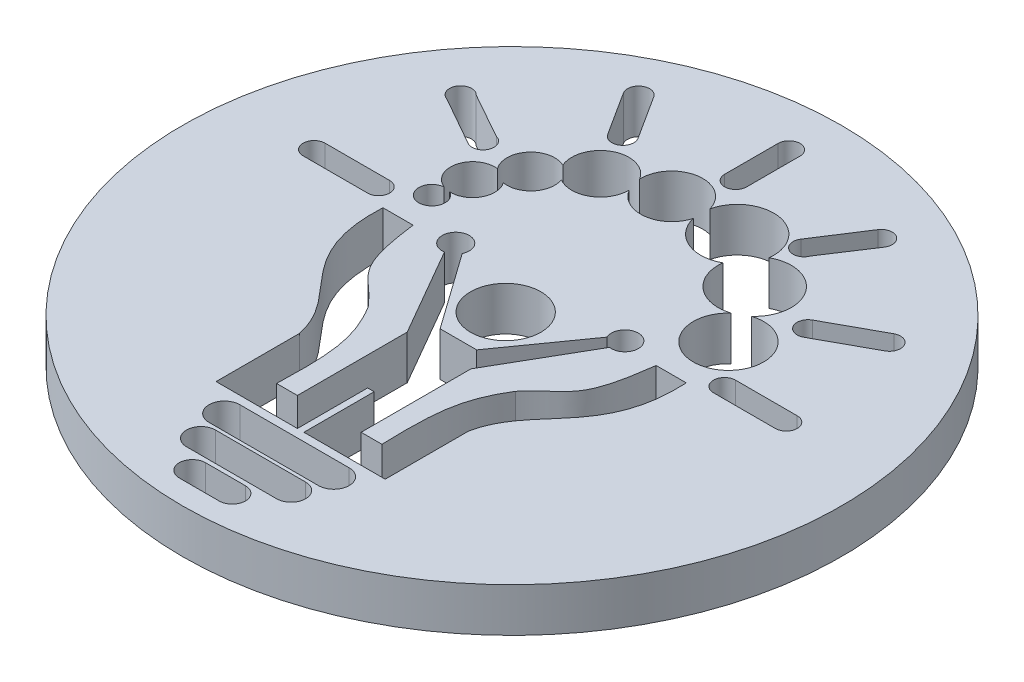
from build123d import *

# Parameters (mm, degrees)
SKETCH2_R           = 75
BOSS_EXTRUDE2_DEPTH = 10
SKETCH1_R           = 8
CUT_EXTRUDE2_DEPTH  = 10


with BuildPart() as part:
    # Sketch2 → Boss-Extrude2 (new body)
    with BuildSketch(Plane(origin=(0, 0, 0), x_dir=(1, 0, 0), z_dir=(0, 1, 0))):
        with Locations(Location((0, 0, 0), (0, 0, 270))):
            Circle(SKETCH2_R)
    extrude(amount=BOSS_EXTRUDE2_DEPTH)

    # Sketch1 → Cut-Extrude2 (cut)
    with BuildSketch(Plane(origin=(0, 0, 0), x_dir=(1, 0, 0), z_dir=(0, 1, 0))):
        with Locations(Location((-1.432800613, 0, 0), (0, 0, 270))):
            Circle(SKETCH1_R)
        with BuildLine():
            Line((-35.952412724, 6.579299902), (-29.089373403, 6.579299902))
            add(Edge.make_bspline(
                [(-29.089373403, 6.579299902), (-27.025622413, -9.672081056), (-24.297966674, -7.419579117), (-18.166448585, -14.521920914)],
                knots=[0, 0, 0, 0, 1, 1, 1, 1], degree=3))
            add(Edge.make_bspline(
                [(-18.166448585, -14.521920914), (-13.477906245, -22.059485723), (-13.054308641, -27.941832091), (-13.424345656, -40.15305356)],
                knots=[0, 0, 0, 0, 1, 1, 1, 1], degree=3))
            Line((-13.424345656, -40.15305356), (-8.687329727, -40.15305356))
            Line((-8.687329727, -40.15305356), (-8.687329727, -15.15305356))
            Line((-8.687329727, -15.15305356), (-20.216966385, 4.843209587))
            ThreePointArc((-20.216966385, 4.843209587), (-22.512806675, 10.333533655), (-17.90159089, 6.571721593))
            Line((-17.90159089, 6.571721593), (-5.592864867, -10.764187934))
            Line((-5.592864867, -10.764187934), (2.72726364, -10.764187934))
            Line((2.72726364, -10.764187934), (15.035989663, 6.571721593))
            ThreePointArc((15.035989663, 6.571721593), (19.647205448, 10.333533655), (17.351365158, 4.843209587))
            Line((17.351365158, 4.843209587), (5.8217285, -15.15305356))
            Line((5.8217285, -15.15305356), (5.8217285, -40.15305356))
            Line((5.8217285, -40.15305356), (10.558744429, -40.15305356))
            add(Edge.make_bspline(
                [(15.300847358, -14.521920914), (10.612305018, -22.059485723), (10.188707415, -27.941832091), (10.558744429, -40.15305356)],
                knots=[0, 0, 0, 0, 1, 1, 1, 1], degree=3))
            add(Edge.make_bspline(
                [(26.223772176, 6.579299902), (24.160021186, -9.672081056), (21.432365448, -7.419579117), (15.300847358, -14.521920914)],
                knots=[0, 0, 0, 0, 1, 1, 1, 1], degree=3))
            Line((26.223772176, 6.579299902), (33.086811497, 6.579299902))
            add(Edge.make_bspline(
                [(33.086811497, 6.579299902), (34.136872369, -13.750794086), (20.402844412, -15.135742794), (17.812300069, -27.718386748)],
                knots=[0, 0, 0, 0, 1, 1, 1, 1], degree=3))
            Line((17.812300069, -27.718386748), (17.812300069, -46.666450461))
            Line((17.812300069, -46.666450461), (-0.691668401, -46.666450461))
            Line((-0.691668401, -46.666450461), (-0.691668401, -30.679021703))
            Line((-0.691668401, -30.679021703), (-1.432800613, -30.679021703))
            Line((-1.432800613, -30.679021703), (-2.173932826, -30.679021703))
            Line((-2.173932826, -30.679021703), (-2.173932826, -46.666450461))
            Line((-2.173932826, -46.666450461), (-20.677901296, -46.666450461))
            Line((-20.677901296, -46.666450461), (-20.677901296, -27.718386748))
            add(Edge.make_bspline(
                [(-35.952412724, 6.579299902), (-37.002473596, -13.750794086), (-23.268445639, -15.135742794), (-20.677901296, -27.718386748)],
                knots=[0, 0, 0, 0, 1, 1, 1, 1], degree=3))
        make_face()
        with BuildLine():
            Line((-31.134175081, 56.453740846), (-24.814846439, 46.586253524))
            ThreePointArc((-24.814846439, 46.586253524), (-21.361233135, 45.829579865), (-20.604559476, 49.283193168))
            Line((-20.604559476, 49.283193168), (-26.984364124, 59.240747711))
            ThreePointArc((-26.984364124, 59.240747711), (-30.483201963, 59.96745797), (-31.134175081, 56.453740846))
        make_face()
        with BuildLine():
            Line((-13.424345656, -48.522506104), (11.473739755, -48.522506104))
            ThreePointArc((11.473739755, -48.522506104), (14.973739755, -52.022506104), (11.473739755, -55.522506104))
            Line((11.473739755, -55.522506104), (-13.424345656, -55.522506104))
            ThreePointArc((-13.424345656, -55.522506104), (-16.924345656, -52.022506104), (-13.424345656, -48.522506104))
        make_face()
        with BuildLine():
            Line((-11.201579128, -56.280200871), (9.314578626, -56.280200871))
            ThreePointArc((9.314578626, -56.280200871), (12.614578626, -59.580200871), (9.314578626, -62.880200871))
            Line((9.314578626, -62.880200871), (-11.201579128, -62.880200871))
            ThreePointArc((-11.201579128, -62.880200871), (-14.501579128, -59.580200871), (-11.201579128, -56.280200871))
        make_face()
        with BuildLine():
            Line((-5.872415439, -63.856077067), (3.199630927, -63.856077067))
            ThreePointArc((3.199630927, -63.856077067), (6.199630927, -66.856077067), (3.199630927, -69.856077067))
            Line((3.199630927, -69.856077067), (-5.872415439, -69.856077067))
            ThreePointArc((-5.872415439, -69.856077067), (-8.872415439, -66.856077067), (-5.872415439, -63.856077067))
        make_face()
        with BuildLine():
            Line((1.332228572, 52.068816937), (1.332228572, 64.224401135))
            ThreePointArc((1.332228572, 64.224401135), (-1.167771428, 66.724401135), (-3.667771428, 64.224401135))
            Line((-3.667771428, 64.224401135), (-3.667771428, 52.068816937))
            ThreePointArc((-3.667771428, 52.068816937), (-1.167771428, 49.568816937), (1.332228572, 52.068816937))
        make_face()
        with BuildLine():
            Line((17.812300069, 47.984100232), (24.687796247, 58.598066559))
            ThreePointArc((24.687796247, 58.598066559), (28.150603832, 59.333538892), (28.877039625, 55.868824335))
            Line((28.877039625, 55.868824335), (22.233533262, 45.729327008))
            ThreePointArc((22.233533262, 45.729327008), (18.749192485, 44.359153526), (17.812300069, 47.984100232))
        make_face()
        with BuildLine():
            Line((38.137038152, 12.721700218), (52.193121227, 12.721700218))
            ThreePointArc((52.193121227, 12.721700218), (54.693121227, 10.221700218), (52.193121227, 7.721700218))
            Line((52.193121227, 7.721700218), (38.137038152, 7.721700218))
            ThreePointArc((38.137038152, 7.721700218), (35.637038152, 10.221700218), (38.137038152, 12.721700218))
        make_face()
        with BuildLine():
            Line((-47.564108381, 39.405649722), (-37.144284237, 33.563931274))
            ThreePointArc((-37.144284237, 33.563931274), (-35.434524966, 30.128871371), (-39.118884044, 29.057231746))
            Line((-39.118884044, 29.057231746), (-50.146349023, 35.309342232))
            ThreePointArc((-50.146349023, 35.309342232), (-51.497079679, 39.022872656), (-47.564108381, 39.405649722))
        make_face()
        with BuildLine():
            Line((-55.264750738, 12.721700218), (-40.570294155, 12.721700218))
            ThreePointArc((-40.570294155, 12.721700218), (-38.070294155, 10.221700218), (-40.570294155, 7.721700218))
            Line((-40.570294155, 7.721700218), (-55.264750738, 7.721700218))
            ThreePointArc((-55.264750738, 7.721700218), (-57.764750738, 10.221700218), (-55.264750738, 12.721700218))
        make_face()
        with BuildLine():
            Line((35.054833416, 33.324298088), (47.015148154, 39.881834455))
            ThreePointArc((47.015148154, 39.881834455), (50.409175042, 38.891591313), (49.4189319, 35.497564425))
            Line((49.4189319, 35.497564425), (37.458617163, 28.940028057))
            ThreePointArc((37.458617163, 28.940028057), (34.064590274, 29.930271199), (35.054833416, 33.324298088))
        make_face()
        with BuildLine():
            ThreePointArc((-33.046716349, 17.625870716), (-33.455059745, 11.692930554), (-31.500963756, 17.309694049))
            ThreePointArc((-31.500963756, 17.309694049), (-26.882220389, 19.905184059), (-27.162966351, 25.195792756))
            ThreePointArc((-27.162966351, 25.195792756), (-22.104048649, 27.055183334), (-21.13695027, 32.357513233))
            ThreePointArc((-21.13695027, 32.357513233), (-14.620111434, 32.395294639), (-11.406386962, 38.06473825))
            ThreePointArc((-11.406386962, 38.06473825), (-4.396601986, 34.681279815), (1.471524132, 39.794984172))
            ThreePointArc((1.471524132, 39.794984172), (6.193027263, 34.08541272), (13.594903675, 34.407939573))
            ThreePointArc((13.594903675, 34.407939573), (16.549089374, 26.949655565), (24.427689797, 25.439401003))
            ThreePointArc((24.427689797, 25.439401003), (33.733708737, 12.53660842), (27.3780871, 27.120507712))
            ThreePointArc((27.3780871, 27.120507712), (28.671886083, 38.175165666), (17.822025263, 40.657079943))
            ThreePointArc((17.822025263, 40.657079943), (11.030714439, 49.871470086), (1.471524132, 43.574743231))
            ThreePointArc((1.471524132, 43.574743231), (-6.400960855, 48.670912402), (-12.400625348, 41.463209157))
            ThreePointArc((-12.400625348, 41.463209157), (-20.931972428, 43.767512306), (-23.888413897, 35.43965845))
            ThreePointArc((-23.888413897, 35.43965845), (-30.449277719, 34.011905286), (-30.611197445, 27.299439629))
            ThreePointArc((-30.611197445, 27.299439629), (-36.148201567, 23.550113394), (-33.046716349, 17.625870716))
        make_face()
    extrude(amount=CUT_EXTRUDE2_DEPTH, mode=Mode.SUBTRACT)


solid = part.part
